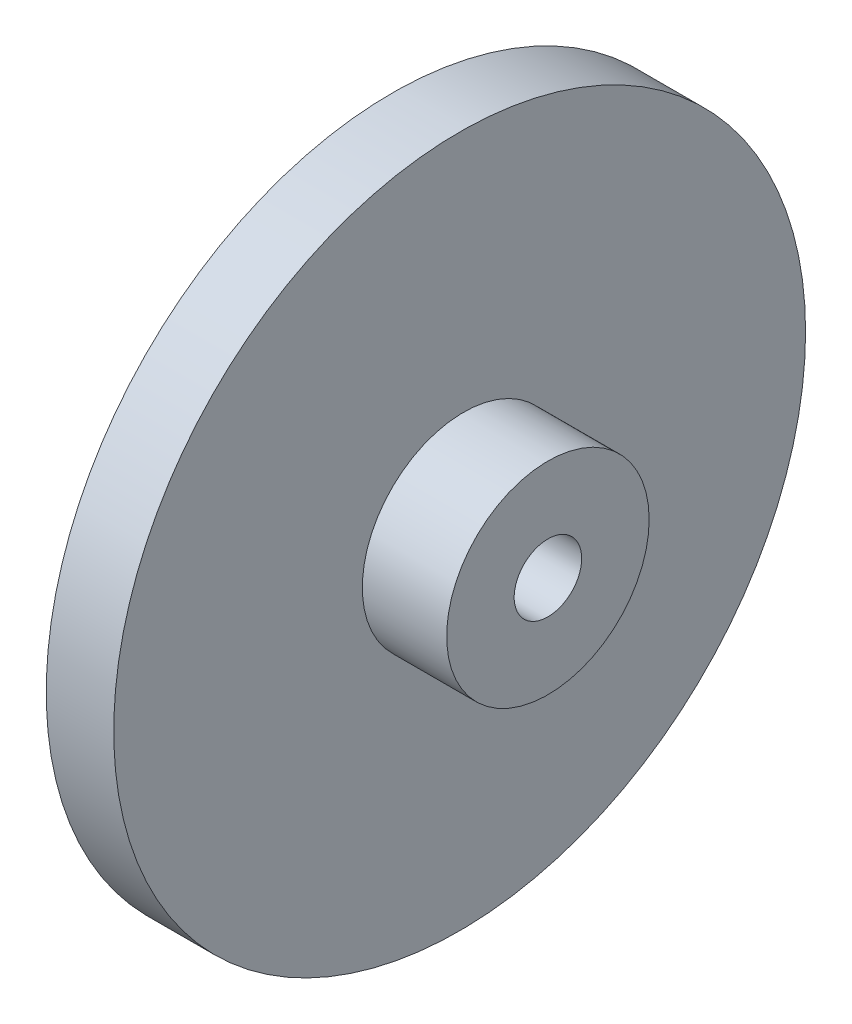
from build123d import *

# Parameters (mm, degrees)
SKETCH1_R           = 20.5
SKETCH1_R_2         = 2
BOSS_EXTRUDE1_DEPTH = 4
SKETCH2_R           = 6
SKETCH2_R_2         = 2
BOSS_EXTRUDE3_DEPTH = 5


with BuildPart() as part:
    # Sketch1 → Boss-Extrude1 (new body)
    with BuildSketch(Plane(origin=(0, 0, 0), x_dir=(0, 0, -1), z_dir=(1, 0, 0))):
        with Locations((0, -0.19719949)):
            Circle(SKETCH1_R)
        with Locations((0.230786774, -0.19719949)):
            Circle(SKETCH1_R_2, mode=Mode.SUBTRACT)
    extrude(amount=BOSS_EXTRUDE1_DEPTH)

    # Sketch2 → Boss-Extrude3 (add)
    with BuildSketch(Plane(origin=(4, 0, 0), x_dir=(0, 0, -1), z_dir=(1, 0, 0))):
        with Locations((0.230786774, -0.19719949)):
            Circle(SKETCH2_R)
        with Locations((0.230786774, -0.19719949)):
            Circle(SKETCH2_R_2, mode=Mode.SUBTRACT)
    extrude(amount=BOSS_EXTRUDE3_DEPTH)


solid = part.part
